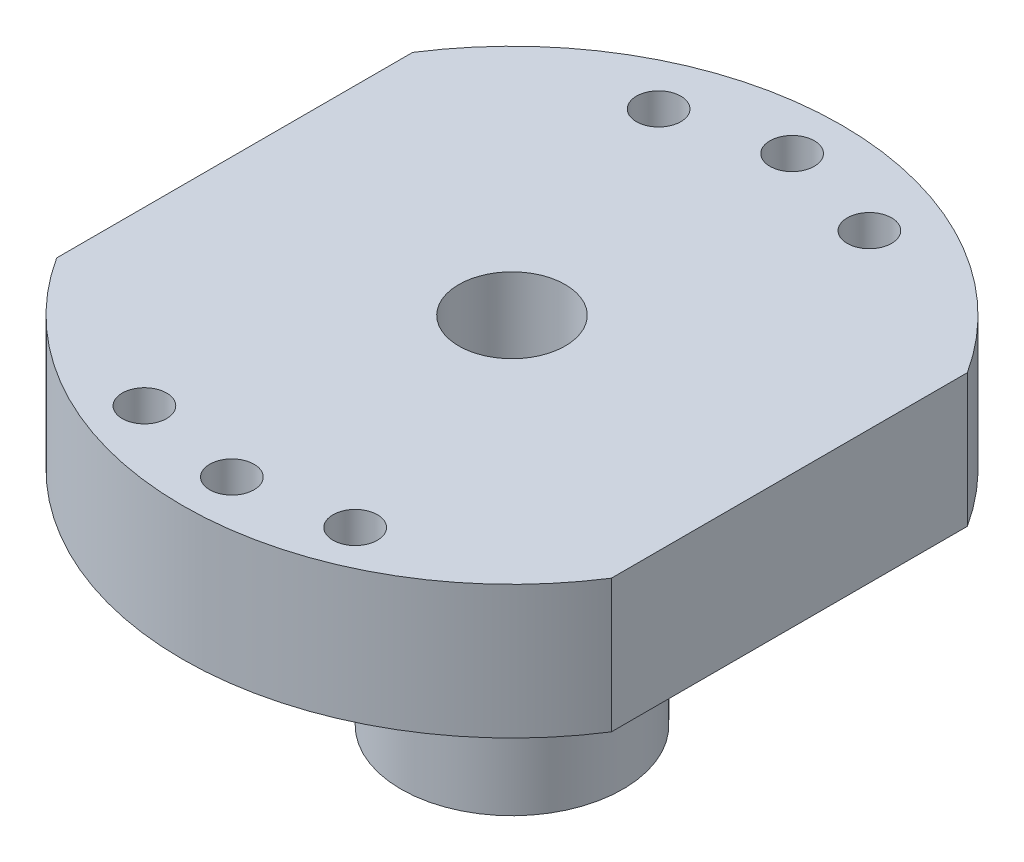
from build123d import *

# Parameters (mm, degrees)
SKETCH1_R           = 2
BOSS_EXTRUDE1_DEPTH = 12
SKETCH2_R           = 4.8
CUT_EXTRUDE1_DEPTH  = 74.394724572
CHAMFER1_SIZE       = 1


with BuildPart() as part:
    # Sketch1 → Boss-Extrude1 (new body)
    # profile 1 of 2: a face of its own
    with BuildSketch(Plane.XZ.offset(18)):
        with BuildLine():
            Line((-23.453342414, -21.61684273), (-23.453342414, -53.703414688))
            ThreePointArc((-23.453342414, -53.703414688), (1.546657586, -67.365128709), (26.546657586, -53.703414688))
            Line((26.546657586, -53.703414688), (26.546657586, -21.61684273))
            ThreePointArc((26.546657586, -21.61684273), (1.546657586, -7.955128709), (-23.453342414, -21.61684273))
        make_face()
        with Locations(Location((-7.953342414, -60.376565813, 0), (0, 0, 270))):
            Circle(SKETCH1_R, mode=Mode.SUBTRACT)
        with BuildLine():
            ThreePointArc((16.671348492, -51.125128709), (1.546657586, -57.910128709), (-13.57803332, -51.125128709))
            Line((-13.57803332, -51.125128709), (-13.57803332, -45.660128709))
            Line((-13.57803332, -45.660128709), (-17.056097586, -45.660128709))
            ThreePointArc((-17.056097586, -45.660128709), (-18.703342414, -37.660128709), (-17.056097586, -29.660128709))
            Line((-17.056097586, -29.660128709), (-13.57803332, -29.660128709))
            Line((-13.57803332, -29.660128709), (-13.57803332, -24.195128709))
            ThreePointArc((-13.57803332, -24.195128709), (1.546657586, -17.410128709), (16.671348492, -24.195128709))
            Line((16.671348492, -24.195128709), (16.671348492, -29.660128709))
            Line((16.671348492, -29.660128709), (20.149412759, -29.660128709))
            Line((20.149412759, -29.660128709), (20.149412759, -32.660128709))
            Line((20.149412759, -32.660128709), (16.671348492, -32.660128709))
            Line((16.671348492, -32.660128709), (16.671348492, -42.660128709))
            Line((16.671348492, -42.660128709), (20.149412759, -42.660128709))
            Line((20.149412759, -42.660128709), (20.149412759, -45.660128709))
            Line((20.149412759, -45.660128709), (16.671348492, -45.660128709))
            Line((16.671348492, -45.660128709), (16.671348492, -51.125128709))
        make_face(mode=Mode.SUBTRACT)
        with Locations(Location((1.546657586, -62.910128709, 0), (0, 0, 270))):
            Circle(SKETCH1_R, mode=Mode.SUBTRACT)
        with Locations(Location((11.046657586, -60.376565813, 0), (0, 0, 270))):
            Circle(SKETCH1_R, mode=Mode.SUBTRACT)
        with Locations(Location((-7.953342414, -14.026565813, 0), (0, 0, 270))):
            Circle(SKETCH1_R, mode=Mode.SUBTRACT)
        with Locations(Location((11.046657586, -14.026565813, 0), (0, 0, 270))):
            Circle(SKETCH1_R, mode=Mode.SUBTRACT)
        with Locations(Location((1.546657586, -12.410128709, 0), (0, 0, 270))):
            Circle(SKETCH1_R, mode=Mode.SUBTRACT)
    # profile 2 of 2: a face of its own
    with BuildSketch(Plane.XZ.offset(18)):
        with BuildLine():
            Line((-13.57803332, -51.125128709), (-13.57803332, -45.660128709))
            Line((-13.57803332, -45.660128709), (-17.056097586, -45.660128709))
            ThreePointArc((-17.056097586, -45.660128709), (-18.703342414, -37.660128709), (-17.056097586, -29.660128709))
            Line((-17.056097586, -29.660128709), (-13.57803332, -29.660128709))
            Line((-13.57803332, -29.660128709), (-13.57803332, -24.195128709))
            ThreePointArc((-13.57803332, -24.195128709), (1.546657586, -17.410128709), (16.671348492, -24.195128709))
            Line((16.671348492, -24.195128709), (16.671348492, -29.660128709))
            Line((16.671348492, -29.660128709), (20.149412759, -29.660128709))
            Line((20.149412759, -29.660128709), (20.149412759, -32.660128709))
            Line((20.149412759, -32.660128709), (16.671348492, -32.660128709))
            Line((16.671348492, -32.660128709), (16.671348492, -42.660128709))
            Line((16.671348492, -42.660128709), (20.149412759, -42.660128709))
            Line((20.149412759, -42.660128709), (20.149412759, -45.660128709))
            Line((20.149412759, -45.660128709), (16.671348492, -45.660128709))
            Line((16.671348492, -45.660128709), (16.671348492, -51.125128709))
            ThreePointArc((16.671348492, -51.125128709), (1.546657586, -57.910128709), (-13.57803332, -51.125128709))
        make_face()
    extrude(amount=BOSS_EXTRUDE1_DEPTH)

    # Sketch2 → Cut-Extrude1 (cut, through all)
    with BuildSketch(Plane.XZ.offset(30)):
        with Locations(Location((1.546657586, -37.660128709, 0), (0, 0, 270))):
            Circle(SKETCH2_R)
    extrude(amount=-CUT_EXTRUDE1_DEPTH, mode=Mode.SUBTRACT)

    # Sketch3 → Revolve1 (revolve)
    with BuildSketch(Plane(origin=(1.546657586, 0, 0), x_dir=(0, 0, -1), z_dir=(1, 0, 0))):
        Polygon((27.660128709, -50), (27.660128709, -30), (32.860128709, -30), (32.860128709, -45), (33.160128709, -45), (33.160128709, -50), align=None)
    revolve(axis=Axis((1.546657586, -30, -37.660128709), (0, -1, 0)))

    # Chamfer1
    chamfer1_edges = [part.edges().sort_by_distance(p)[0] for p in [
        (1.546657586, -50, -42.160128709),
    ]]
    chamfer(chamfer1_edges, length=CHAMFER1_SIZE)


solid = part.part
